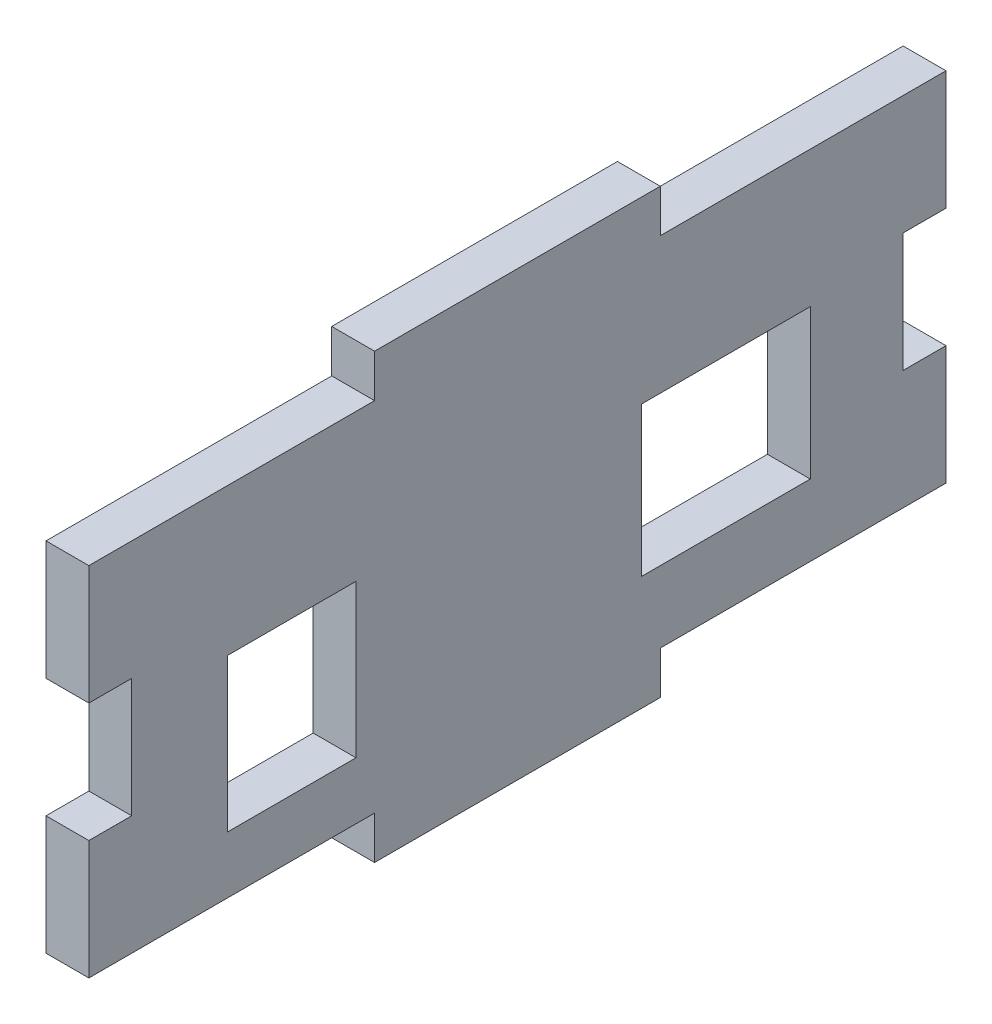
from build123d import *

# Parameters (mm, degrees)
SIDES_W              = 11.8
SIDES_H              = 10.45
SIDES_W_2            = 9
SIDES_H_2            = 10.7
SIDES_EXTRUDED_DEPTH = 3


with BuildPart() as part:
    # Sides → Sides Extruded (new body)
    with BuildSketch(Plane(origin=(0, 0, 0), x_dir=(0, 0, -1), z_dir=(1, 0, 0))):
        Polygon((0, 16.66666666), (0, 25), (20, 25), (20, 28), (40, 28), (40, 25), (60, 25), (60, 16.66666666), (57, 16.66666666), (57, 8.33333333), (60, 8.33333333), (60, 0), (40, 0), (40, -3), (20, -3), (20, 0), (0, 0), (0, 8.33333333), (3, 8.33333333), (3, 16.66666666), align=None)
        with Locations((44.6, 10.225)):
            Rectangle(SIDES_W, SIDES_H, mode=Mode.SUBTRACT)
        with Locations((14.2, 9.35)):
            Rectangle(SIDES_W_2, SIDES_H_2, mode=Mode.SUBTRACT)
    extrude(amount=SIDES_EXTRUDED_DEPTH)


solid = part.part
